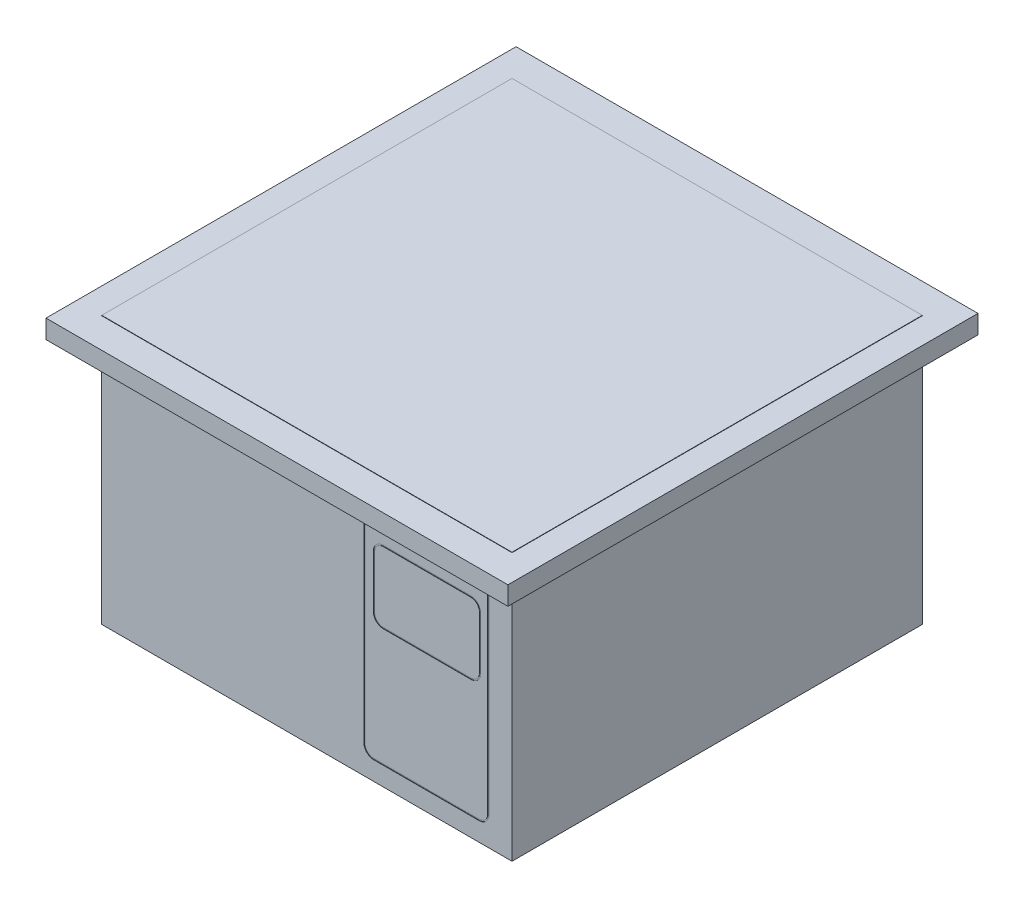
from build123d import *

# Parameters (mm, degrees)
CROQUIS1_W              = 3300
CROQUIS1_H              = 3300
CROQUIS1_W_2            = 3000
CROQUIS1_H_2            = 3000
SALIENTE_EXTRUIR1_DEPTH = 2000
CROQUIS2_W              = 3715.107812374
CROQUIS2_H              = 3780.923334612
CROQUIS2_W_2            = 3300
CROQUIS2_H_2            = 3300
SALIENTE_EXTRUIR2_DEPTH = 150
CORTAR_EXTRUIR1_DEPTH   = 3
CORTAR_EXTRUIR2_DEPTH   = 3
CROQUIS5_W              = 3300
CROQUIS5_H              = 3300
SALIENTE_EXTRUIR3_DEPTH = 3


with BuildPart() as part:
    # Croquis1 → Saliente-Extruir1 (new body)
    with BuildSketch(Plane(origin=(0, 0, 0), x_dir=(1, 0, 0), z_dir=(0, 1, 0))):
        Rectangle(CROQUIS1_W, CROQUIS1_H)
        Rectangle(CROQUIS1_W_2, CROQUIS1_H_2, mode=Mode.SUBTRACT)
    extrude(amount=SALIENTE_EXTRUIR1_DEPTH)

    # Croquis3 → Cortar-Extruir1 (cut)
    with BuildSketch(Plane.XY.offset(1650)):
        with BuildLine():
            Line((458.693356997, 1745.135347933), (458.693356997, 231.101371952))
            ThreePointArc((458.693356997, 231.101371952), (482.124814502, 174.532829457), (538.693356997, 151.101371952))
            Line((538.693356997, 151.101371952), (1384.461320744, 151.101371952))
            ThreePointArc((1384.461320744, 151.101371952), (1441.029863239, 174.532829457), (1464.461320744, 231.101371952))
            Line((1464.461320744, 231.101371952), (1464.461320744, 1745.135347933))
            ThreePointArc((1464.461320744, 1745.135347933), (1441.029863239, 1801.703890428), (1384.461320744, 1825.135347933))
            Line((1384.461320744, 1825.135347933), (538.693356997, 1825.135347933))
            ThreePointArc((538.693356997, 1825.135347933), (482.124814502, 1801.703890428), (458.693356997, 1745.135347933))
        make_face()
        with BuildLine():
            Line((538.693356997, 1815.135347933), (1384.461320744, 1815.135347933))
            ThreePointArc((1384.461320744, 1815.135347933), (1433.958795427, 1794.632822616), (1454.461320744, 1745.135347933))
            Line((1454.461320744, 1745.135347933), (1454.461320744, 231.101371952))
            ThreePointArc((1454.461320744, 231.101371952), (1433.958795427, 181.603897269), (1384.461320744, 161.101371952))
            Line((1384.461320744, 161.101371952), (538.693356997, 161.101371952))
            ThreePointArc((538.693356997, 161.101371952), (489.195882313, 181.603897269), (468.693356997, 231.101371952))
            Line((468.693356997, 231.101371952), (468.693356997, 1745.135347933))
            ThreePointArc((468.693356997, 1745.135347933), (489.195882313, 1794.632822616), (538.693356997, 1815.135347933))
        make_face(mode=Mode.SUBTRACT)
    extrude(amount=-CORTAR_EXTRUIR1_DEPTH, mode=Mode.SUBTRACT)

    # Croquis4 → Cortar-Extruir2 (cut)
    with BuildSketch(Plane.XY.offset(1650)):
        with BuildLine():
            Line((535.242823134, 1604.170281482), (535.242823134, 1181.915657145))
            ThreePointArc((535.242823134, 1181.915657145), (558.674280639, 1125.34711465), (615.242823134, 1101.915657145))
            Line((615.242823134, 1101.915657145), (1318.624759638, 1101.915657145))
            ThreePointArc((1318.624759638, 1101.915657145), (1375.193302133, 1125.34711465), (1398.624759638, 1181.915657145))
            Line((1398.624759638, 1181.915657145), (1398.624759638, 1604.170281482))
            ThreePointArc((1398.624759638, 1604.170281482), (1375.193302133, 1660.738823977), (1318.624759638, 1684.170281482))
            Line((1318.624759638, 1684.170281482), (615.242823134, 1684.170281482))
            ThreePointArc((615.242823134, 1684.170281482), (558.674280639, 1660.738823977), (535.242823134, 1604.170281482))
        make_face()
        with BuildLine():
            Line((615.242823134, 1674.170281482), (1318.624759638, 1674.170281482))
            ThreePointArc((1318.624759638, 1674.170281482), (1368.122234322, 1653.667756165), (1388.624759638, 1604.170281482))
            Line((1388.624759638, 1604.170281482), (1388.624759638, 1181.915657145))
            ThreePointArc((1388.624759638, 1181.915657145), (1368.122234322, 1132.418182462), (1318.624759638, 1111.915657145))
            Line((1318.624759638, 1111.915657145), (615.242823134, 1111.915657145))
            ThreePointArc((615.242823134, 1111.915657145), (565.74534845, 1132.418182462), (545.242823134, 1181.915657145))
            Line((545.242823134, 1181.915657145), (545.242823134, 1604.170281482))
            ThreePointArc((545.242823134, 1604.170281482), (565.74534845, 1653.667756165), (615.242823134, 1674.170281482))
        make_face(mode=Mode.SUBTRACT)
    extrude(amount=-CORTAR_EXTRUIR2_DEPTH, mode=Mode.SUBTRACT)


with BuildPart() as body_2:
    # Croquis2 → Saliente-Extruir2 (new body)
    with BuildSketch(Plane(origin=(0, 2000, 0), x_dir=(1, 0, 0), z_dir=(0, 1, 0))):
        Rectangle(CROQUIS2_W, CROQUIS2_H)
        Rectangle(CROQUIS2_W_2, CROQUIS2_H_2, mode=Mode.SUBTRACT)
    extrude(amount=SALIENTE_EXTRUIR2_DEPTH)


with BuildPart() as body_3:
    # Croquis5 → Saliente-Extruir3 (new body)
    with BuildSketch(Plane(origin=(0, 2150, 0), x_dir=(1, 0, 0), z_dir=(0, 1, 0))):
        Rectangle(CROQUIS5_W, CROQUIS5_H)
    extrude(amount=SALIENTE_EXTRUIR3_DEPTH)


solid = Compound([part.part, body_2.part, body_3.part])
